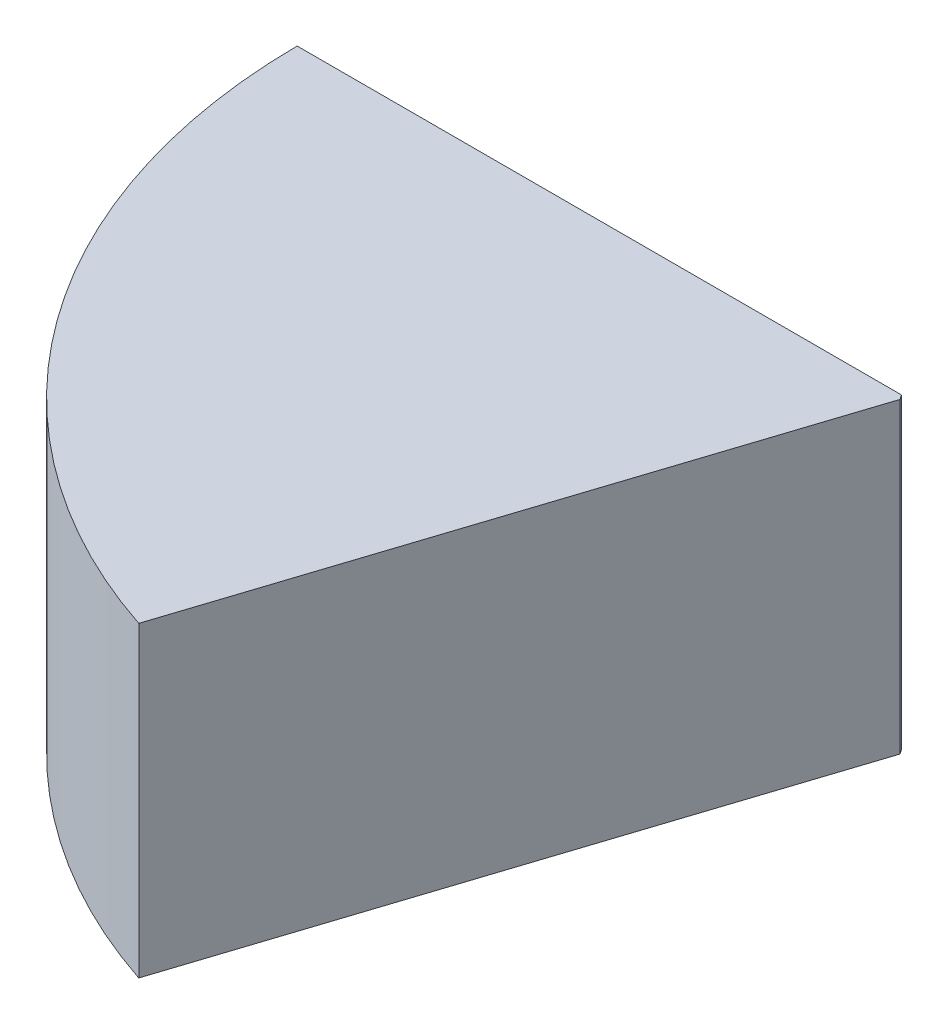
from build123d import *

# Parameters (mm, degrees)
SKETCH1_W          = 101.6
SKETCH1_H          = 50.8
REVOLVE1_ANGLE     = 72
SKETCH2_W          = 101.6
SKETCH2_H          = 50.8
CUT_EXTRUDE1_DEPTH = 0.635
SKETCH3_W          = 100.932321488
SKETCH3_H          = 50.8
CUT_EXTRUDE2_DEPTH = 0.635
CUT_EXTRUDE3_REACH = 151.001


with BuildPart() as part:
    # Sketch1 → Revolve1 (revolve)
    with BuildSketch(Plane.XY):
        with Locations((-50.8, 25.4)):
            Rectangle(SKETCH1_W, SKETCH1_H)
    revolve(axis=Axis((0, 0, 0), (0, 1, 0)), revolution_arc=REVOLVE1_ANGLE)

    # Sketch2 → Cut-Extrude1 (cut)
    with BuildSketch(Plane(origin=(0, 0, 0), x_dir=(0.3090169943749449, 0, -0.9510565162951544), z_dir=(0.9510565162951544, 0, 0.3090169943749449))):
        with Locations((-50.8, 25.4)):
            Rectangle(SKETCH2_W, SKETCH2_H)
    extrude(amount=-CUT_EXTRUDE1_DEPTH, mode=Mode.SUBTRACT)

    # Sketch3 → Cut-Extrude2 (cut)
    with BuildSketch(Plane(origin=(0, 0, 0), x_dir=(-1, 0, 0), z_dir=(0, 0, -1))):
        with Locations((51.133839256, 25.4)):
            Rectangle(SKETCH3_W, SKETCH3_H)
    extrude(amount=-CUT_EXTRUDE2_DEPTH, mode=Mode.SUBTRACT)

    # Sketch4 → Cut-Extrude3 (cut, up to next)
    with BuildSketch(Plane(origin=(0, 50.8, 0), x_dir=(1, 0, 0), z_dir=(0, 1, 0)), mode=Mode.PRIVATE) as cut_extrude3_sk1:
        Polygon((-1.116550937, -1.38148727), (-1.658905685, -0.635), (-0.874002519, -0.635), align=None)
    cut_extrude3_tool1 = extrude(cut_extrude3_sk1.sketch, amount=-CUT_EXTRUDE3_REACH, mode=Mode.PRIVATE) & part.part
    add(cut_extrude3_tool1.solids().sort_by_distance((-1.216486, 50.8, 0.883829))[0], mode=Mode.SUBTRACT)


solid = part.part
